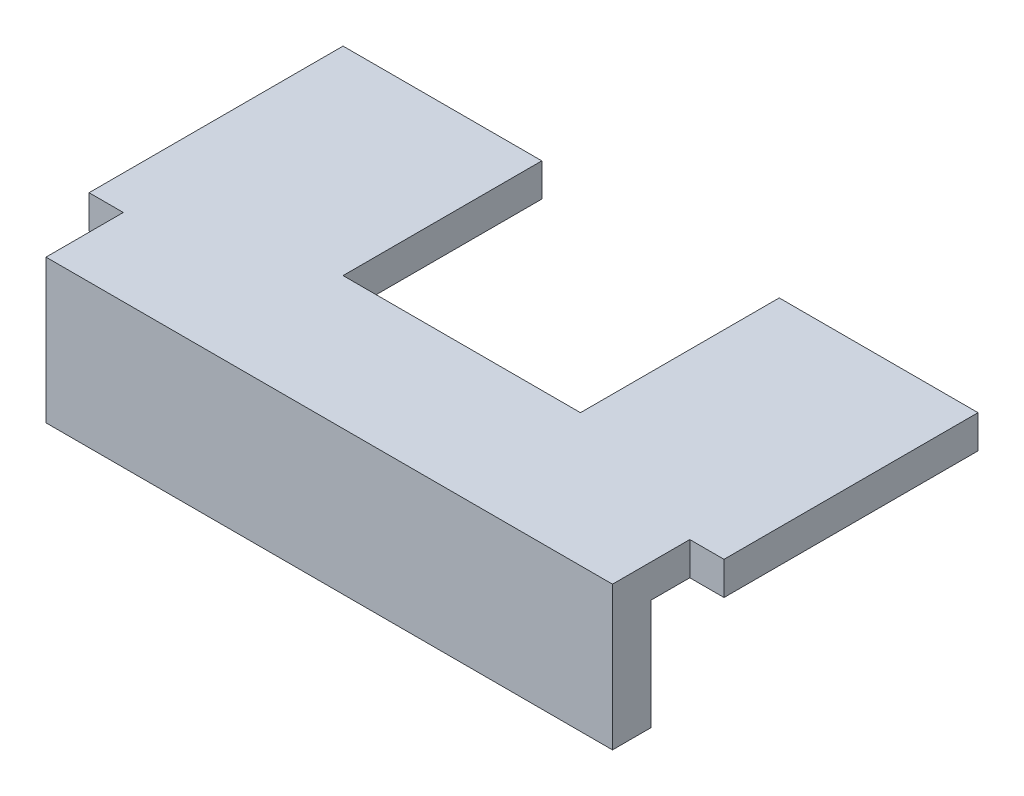
from build123d import *

# Parameters (mm, degrees)
BOSS_EXTRUDE1_DEPTH = 3
SKETCH3_W           = 51.3
SKETCH3_H           = 3.5
BOSS_EXTRUDE2_DEPTH = 10


with BuildPart() as part:
    # Sketch2 → Boss-Extrude1 (new body)
    with BuildSketch(Plane(origin=(0, 0, 0), x_dir=(1, 0, 0), z_dir=(0, 1, 0))):
        Polygon((-25.65, 0), (0, 0), (0, 12), (-10.75, 12), (-10.75, 30), (-28.75, 30), (-28.75, 7), (-25.65, 7), align=None)
        Polygon((0, 0), (25.65, 0), (25.65, 7), (28.75, 7), (28.75, 30), (10.75, 30), (10.75, 12), (0, 12), align=None)
    extrude(amount=BOSS_EXTRUDE1_DEPTH)

    # Sketch3 → Boss-Extrude2 (add)
    with BuildSketch(Plane.XZ):
        with Locations((0, -1.75)):
            Rectangle(SKETCH3_W, SKETCH3_H)
    extrude(amount=BOSS_EXTRUDE2_DEPTH)


solid = part.part
